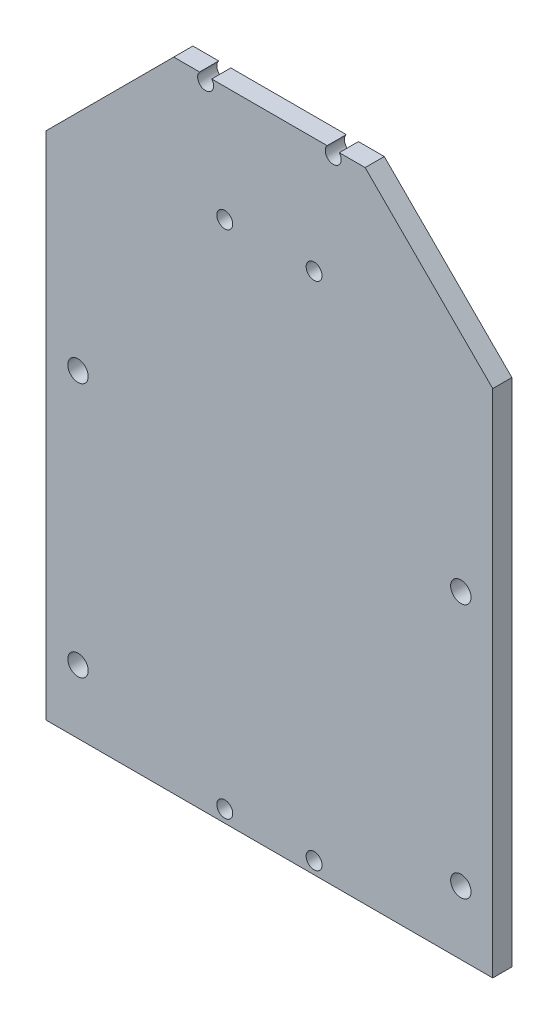
from build123d import *

# Parameters (mm, degrees)
SKETCH_1_W          = 70
SKETCH_1_H          = 100
EXTRUDE_1_DEPTH     = 3
SKETCH_2_R          = 1.6
CUT_EXTRUDE_1_DEPTH = 3
SKETCH_3_R          = 1.25
CUT_EXTRUDE_2_DEPTH = 3
CHAMFER_1_SIZE      = 20


with BuildPart() as part:
    # 草图1 → 凸台-拉伸1 (new body)
    with BuildSketch(Plane.XY):
        with Locations((-44.233232324, 72.350653578)):
            Rectangle(SKETCH_1_W, SKETCH_1_H)
    extrude(amount=EXTRUDE_1_DEPTH)

    # 草图2 → 切除-拉伸1 (cut)
    with BuildSketch(Plane.XY.offset(3)):
        with Locations((-74.233232324, 32.350653578)):
            Circle(SKETCH_2_R)
        with Locations((-14.233232324, 32.350653578)):
            Circle(SKETCH_2_R)
        with Locations((-14.233232324, 72.286219849)):
            Circle(SKETCH_2_R)
        with Locations((-74.233232324, 72.286219849)):
            Circle(SKETCH_2_R)
    extrude(amount=-CUT_EXTRUDE_1_DEPTH, mode=Mode.SUBTRACT)

    # 草图3 → 切除-拉伸2 (cut)
    with BuildSketch(Plane(origin=(0, 0, 0), x_dir=(-1, 0, 0), z_dir=(0, 0, -1))):
        with Locations((37.233066324, 104.286219849)):
            Circle(SKETCH_3_R)
        with Locations((51.233066324, 104.286219849)):
            Circle(SKETCH_3_R)
        with Locations((37.233066324, 24.286219849)):
            Circle(SKETCH_3_R)
        with Locations((51.233066324, 24.286219849)):
            Circle(SKETCH_3_R)
        with Locations((34.233232324, 121.536231848)):
            Circle(SKETCH_3_R)
        with Locations((54.233232324, 121.536231848)):
            Circle(SKETCH_3_R)
    extrude(amount=-CUT_EXTRUDE_2_DEPTH, mode=Mode.SUBTRACT)

    # 倒角1
    chamfer_1_edges = [part.edges().sort_by_distance(p)[0] for p in [
        (-79.233232324, 122.350653578, 1.5),
        (-9.233232324, 122.350653578, 1.5),
    ]]
    chamfer(chamfer_1_edges, length=CHAMFER_1_SIZE)


solid = part.part
